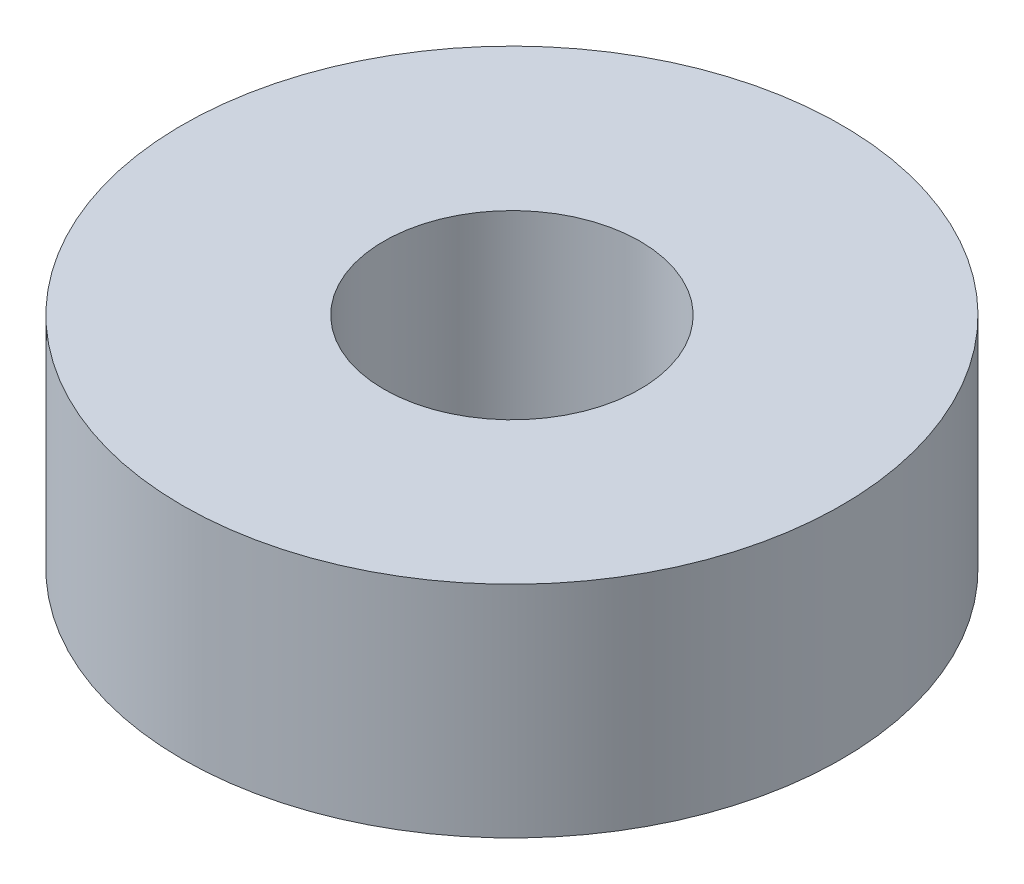
from build123d import *

# Parameters (mm, degrees)
SKETCH_2_R      = 4.5
SKETCH_2_R_2    = 1.75
EXTRUDE_1_DEPTH = 3


with BuildPart() as part:
    # 草图2 → 凸台-拉伸1 (new body)
    with BuildSketch(Plane(origin=(0, 0, 0), x_dir=(1, 0, 0), z_dir=(0, 1, 0))):
        with Locations(Location((0, 0, 0), (0, 0, 270))):
            Circle(SKETCH_2_R)
        with Locations(Location((0, 0, 0), (0, 0, 270))):
            Circle(SKETCH_2_R_2, mode=Mode.SUBTRACT)
    extrude(amount=EXTRUDE_1_DEPTH)


solid = part.part
